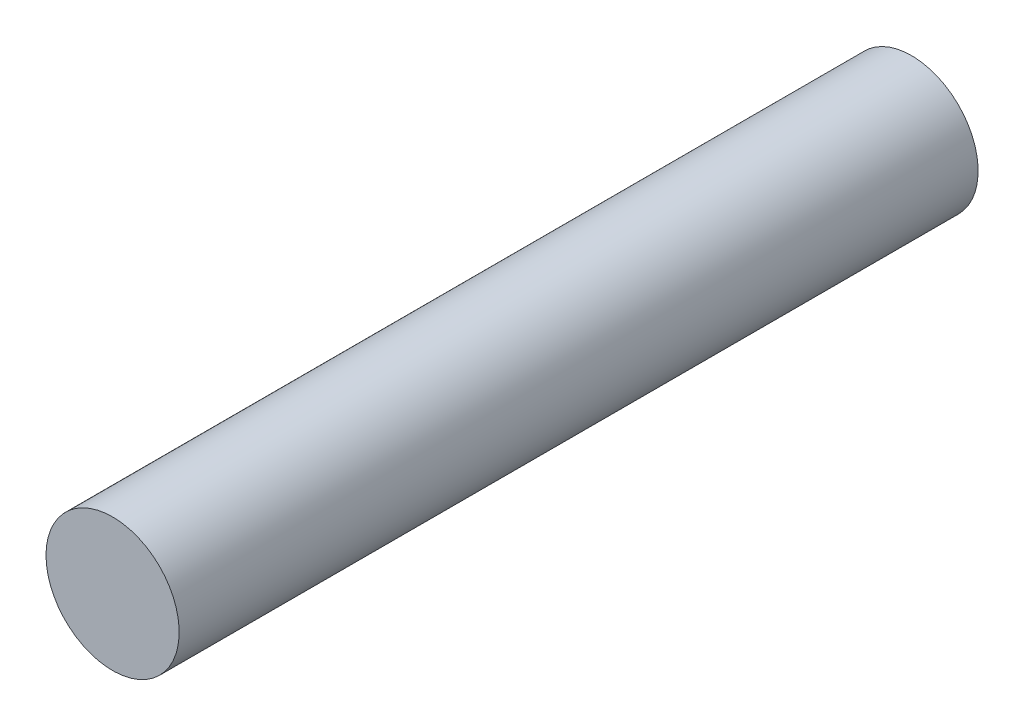
from build123d import *

# Parameters (mm, degrees)
SKETCH2_R           = 6.35
BOSS_EXTRUDE1_DEPTH = 76.2


with BuildPart() as part:
    # Sketch2 → Boss-Extrude1 (new body)
    with BuildSketch(Plane.XY):
        with Locations(Location((0, 0, 0), (0, 0, 180))):
            Circle(SKETCH2_R)
    extrude(amount=BOSS_EXTRUDE1_DEPTH)


solid = part.part
